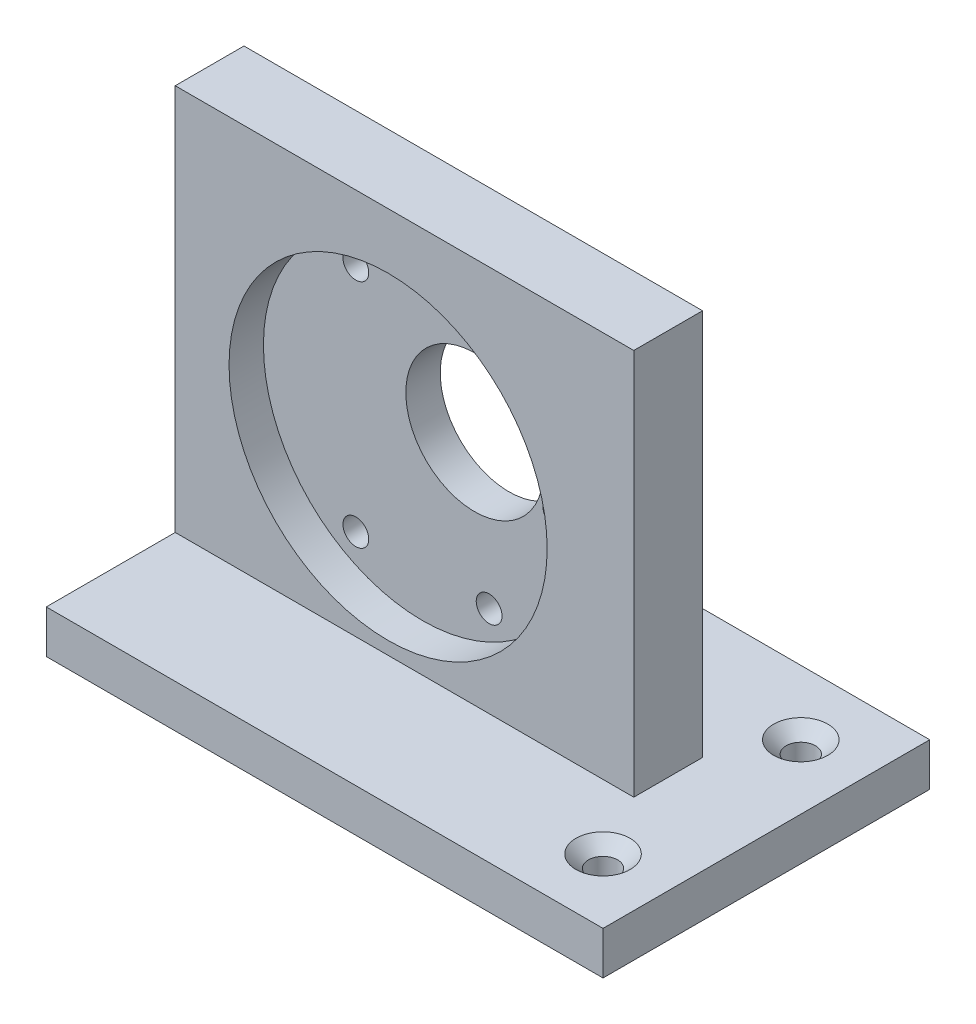
from build123d import *

# Parameters (mm, degrees)
SKETCH3_W                                       = 57.15
SKETCH3_H                                       = 50
BOSS_EXTRUDE1_DEPTH                             = 8
SKETCH3_3_R                                     = 1.5
SKETCH3_3_R_2                                   = 8
CUT_EXTRUDE2_DEPTH                              = 10
SKETCH4_R                                       = 18.5
CUT_EXTRUDE3_DEPTH                              = 4
BOSS_EXTRUDE2_DEPTH                             = 15
BOSS_EXTRUDE2_DEPTH_BACK                        = 23
SKETCH6_W                                       = 80
SKETCH6_H                                       = 5
CSK_FOR_M3_FLAT_HEAD_MACHINE_SCREW1_D           = 3.4
CSK_FOR_M3_FLAT_HEAD_MACHINE_SCREW1_CSINK_D     = 6.3
CSK_FOR_M3_FLAT_HEAD_MACHINE_SCREW1_CSINK_ANGLE = 90
CUT_EXTRUDE8_REACH                              = 66.452
SKETCH14_W                                      = 15.24
SKETCH14_H                                      = 38
CUT_EXTRUDE8_DIRECTION_2_DEPTH                  = 45


with BuildPart() as part:
    # Sketch3 → Boss-Extrude1 (new body)
    with BuildSketch(Plane.XY):
        with Locations((0, 25)):
            Rectangle(SKETCH3_W, SKETCH3_H)
    extrude(amount=BOSS_EXTRUDE1_DEPTH)

    # Sketch3<3> → Cut-Extrude2 (cut)
    with BuildSketch(Plane.XY):
        with Locations(Location((-7.75, 38.423393759, 0), (0, 0, 180))):
            Circle(SKETCH3_3_R)
        with Locations(Location((7.75, 38.423393759, 0), (0, 0, 180))):
            Circle(SKETCH3_3_R)
        with Locations(Location((-7.75, 11.576606241, 0), (0, 0, 180))):
            Circle(SKETCH3_3_R)
        with Locations(Location((7.75, 11.576606241, 0), (0, 0, 180))):
            Circle(SKETCH3_3_R)
        with Locations(Location((15.5, 25, 0), (0, 0, 180))):
            Circle(SKETCH3_3_R)
        with Locations(Location((6.062177825, 28.499999999, 0), (0, 0, 180))):
            Circle(SKETCH3_3_R_2)
    extrude(amount=CUT_EXTRUDE2_DEPTH, mode=Mode.SUBTRACT)

    # Sketch4 → Cut-Extrude3 (cut)
    with BuildSketch(Plane.XY.offset(8)):
        with Locations((0, 25)):
            Circle(SKETCH4_R)
    extrude(amount=-CUT_EXTRUDE3_DEPTH, mode=Mode.SUBTRACT)

    # Sketch6 → Boss-Extrude2 (add, two sides: drawn at the far end of the back side and taken through both)
    with BuildSketch(Plane.XY.offset(8).offset(-BOSS_EXTRUDE2_DEPTH_BACK)):
        with Locations((0, 2.5)):
            Rectangle(SKETCH6_W, SKETCH6_H)
    extrude(amount=BOSS_EXTRUDE2_DEPTH + BOSS_EXTRUDE2_DEPTH_BACK)

    # CSK for M3 Flat Head Machine Screw1 (through all)
    with Locations(Plane(origin=(0, 5, 0), x_dir=(1, 0, 0), z_dir=(0, 1, 0))):
        with Locations((-32.5, 7.5), (-32.5, -15.5), (32.5, -15.5), (32.5, 7.5)):
            CounterSinkHole(CSK_FOR_M3_FLAT_HEAD_MACHINE_SCREW1_D / 2, CSK_FOR_M3_FLAT_HEAD_MACHINE_SCREW1_CSINK_D / 2, counter_sink_angle=CSK_FOR_M3_FLAT_HEAD_MACHINE_SCREW1_CSINK_ANGLE)

    # Sketch14 → Cut-Extrude8 (cut, up to next)
    with BuildSketch(Plane(origin=(0, 5, 0), x_dir=(1, 0, 0), z_dir=(0, 1, 0)), mode=Mode.PRIVATE) as cut_extrude8_sk1:
        with Locations((-32.38, -4)):
            Rectangle(SKETCH14_W, SKETCH14_H)
    cut_extrude8_tool1 = extrude(cut_extrude8_sk1.sketch, amount=-CUT_EXTRUDE8_REACH, mode=Mode.PRIVATE) & part.part
    add(cut_extrude8_tool1.solids().sort_by_distance((-32.38, 5, 4))[0], mode=Mode.SUBTRACT)

    # Sketch14 → Cut-Extrude8 direction 2 (cut)
    with BuildSketch(Plane(origin=(0, 5, 0), x_dir=(1, 0, 0), z_dir=(0, 1, 0))):
        with Locations((-32.38, -4)):
            Rectangle(SKETCH14_W, SKETCH14_H)
    extrude(amount=CUT_EXTRUDE8_DIRECTION_2_DEPTH, mode=Mode.SUBTRACT)


solid = part.part
